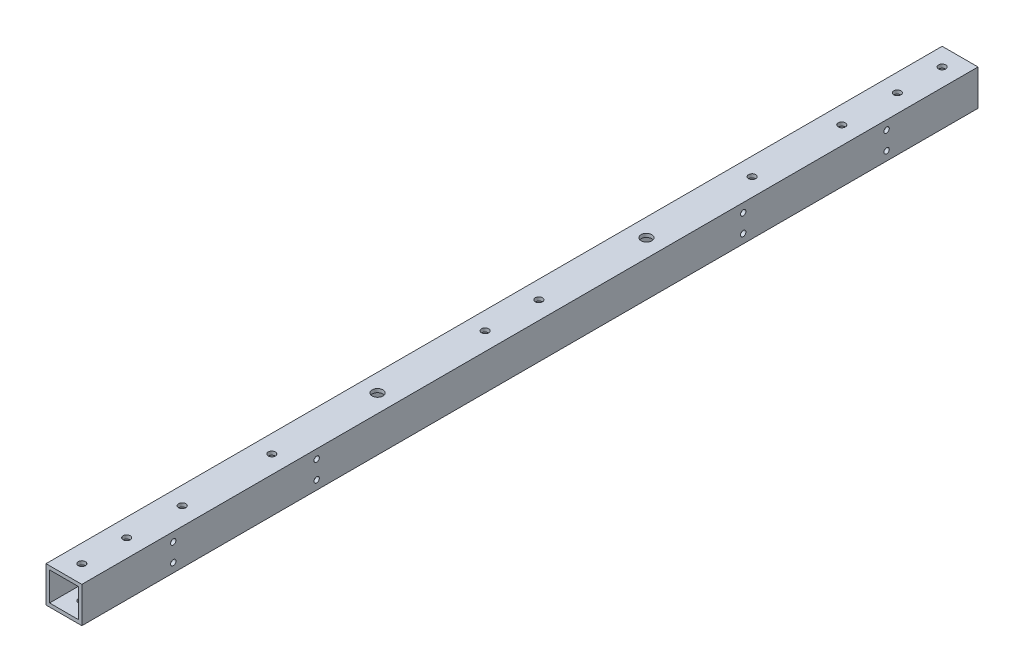
from build123d import *

# Parameters (mm, degrees)
SKETCH_1_W          = 20
SKETCH_1_H          = 20
SKETCH_1_W_2        = 16
SKETCH_1_H_2        = 16
EXTRUDE_1_DEPTH     = 500
SKETCH_2_R          = 3
SKETCH_2_R_2        = 2
CUT_EXTRUDE_1_DEPTH = 501.799361022
SKETCH_3_R          = 1.5
CUT_EXTRUDE_2_DEPTH = 501.799361022
SKETCH_4_R          = 2
CUT_EXTRUDE_3_DEPTH = 501.799361022


with BuildPart() as part:
    # 草图1 → 凸台-拉伸1 (new body)
    with BuildSketch(Plane.XY):
        with Locations((10, 10)):
            Rectangle(SKETCH_1_W, SKETCH_1_H)
        with Locations((10, 10)):
            Rectangle(SKETCH_1_W_2, SKETCH_1_H_2, mode=Mode.SUBTRACT)
    extrude(amount=EXTRUDE_1_DEPTH)

    # 草图2 → 切除-拉伸1 (cut, through all)
    with BuildSketch(Plane(origin=(0, 0, 0), x_dir=(1, 0, 0), z_dir=(0, 1, 0))):
        with Locations(Location((10, -175, 0), (0, 0, 90))):
            Circle(SKETCH_2_R)
        with Locations(Location((10, -325, 0), (0, 0, 90))):
            Circle(SKETCH_2_R)
        with Locations(Location((10, -10, 0), (0, 0, 90))):
            Circle(SKETCH_2_R_2)
        with Locations(Location((10, -66, 0), (0, 0, 90))):
            Circle(SKETCH_2_R_2)
        with Locations(Location((10, -116, 0), (0, 0, 90))):
            Circle(SKETCH_2_R_2)
        with Locations(Location((10, -35, 0), (0, 0, 90))):
            Circle(SKETCH_2_R_2)
        with Locations(Location((10, -384, 0), (0, 0, 90))):
            Circle(SKETCH_2_R_2)
        with Locations(Location((10, -434, 0), (0, 0, 90))):
            Circle(SKETCH_2_R_2)
        with Locations(Location((10, -465, 0), (0, 0, 90))):
            Circle(SKETCH_2_R_2)
        with Locations(Location((10, -490, 0), (0, 0, 90))):
            Circle(SKETCH_2_R_2)
    extrude(amount=CUT_EXTRUDE_1_DEPTH, mode=Mode.SUBTRACT)

    # 草图3 → 切除-拉伸2 (cut, through all)
    with BuildSketch(Plane(origin=(0, 0, 0), x_dir=(0, 0, -1), z_dir=(1, 0, 0))):
        with Locations(Location((-449, 15, 0), (0, 0, 270))):
            Circle(SKETCH_3_R)
        with Locations(Location((-449, 5, 0), (0, 0, 180))):
            Circle(SKETCH_3_R)
        with Locations(Location((-369, 5, 0), (0, 0, 270))):
            Circle(SKETCH_3_R)
        with Locations(Location((-369, 15, 0), (0, 0, 180))):
            Circle(SKETCH_3_R)
        with Locations(Location((-131, 15, 0), (0, 0, 270))):
            Circle(SKETCH_3_R)
        with Locations(Location((-131, 5, 0), (0, 0, 180))):
            Circle(SKETCH_3_R)
        with Locations(Location((-51, 5, 0), (0, 0, 270))):
            Circle(SKETCH_3_R)
        with Locations(Location((-51, 15, 0), (0, 0, 180))):
            Circle(SKETCH_3_R)
    extrude(amount=CUT_EXTRUDE_2_DEPTH, mode=Mode.SUBTRACT)

    # 草图4 → 切除-拉伸3 (cut, through all)
    with BuildSketch(Plane(origin=(0, 20, 0), x_dir=(1, 0, 0), z_dir=(0, 1, 0))):
        with Locations(Location((10, -265, 0), (0, 0, 270))):
            Circle(SKETCH_4_R)
        with Locations(Location((10, -235, 0), (0, 0, 270))):
            Circle(SKETCH_4_R)
    extrude(amount=-CUT_EXTRUDE_3_DEPTH, mode=Mode.SUBTRACT)


solid = part.part
